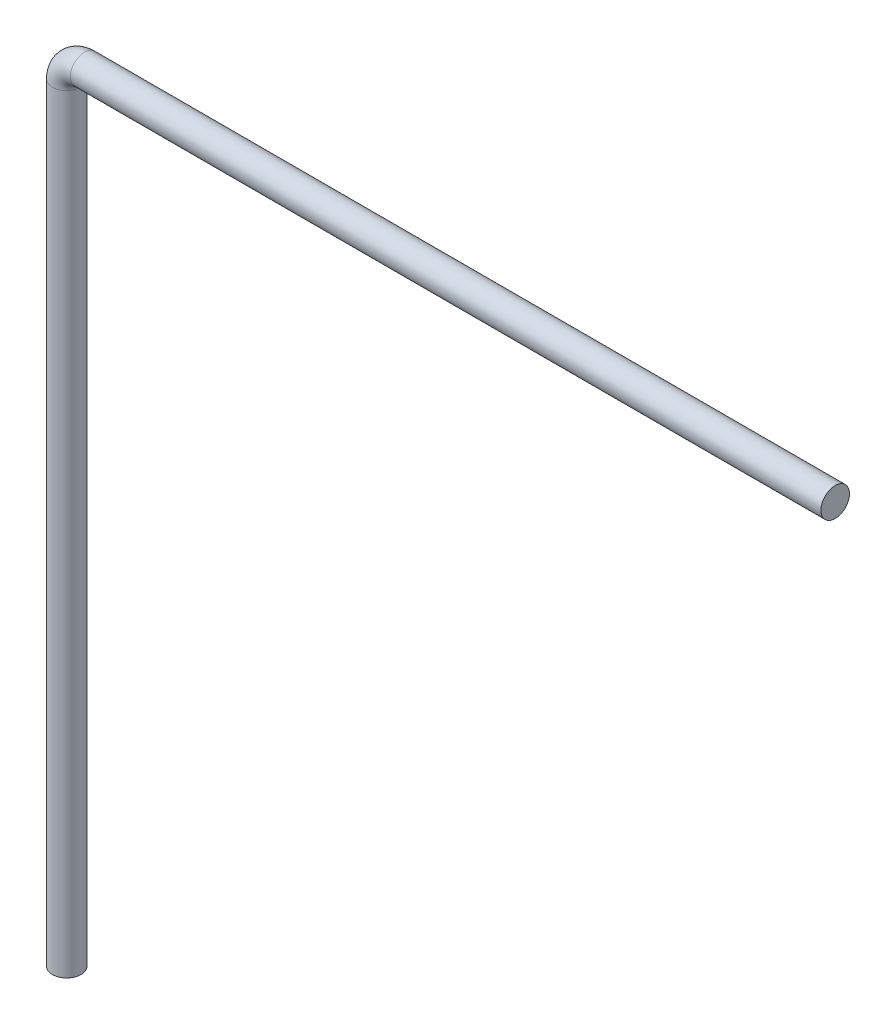
from build123d import *

# Parameters (mm, degrees)
SKETCH_2_R = 0.4


with BuildPart() as part:
    # По траектории1: sweep along a path in Эскиз1
    with BuildLine(Plane.XY) as sweep_1_path:
        Line((0, 0), (0, 21.5))
        ThreePointArc((0, 21.5), (0.146446609, 21.853553391), (0.5, 22))
        Line((0.5, 22), (21.5, 22))
    # Эскиз2 → По траектории1 (sweep)
    with BuildSketch(Plane(origin=(0, 0, 0), x_dir=(1, 0, 0), z_dir=(0, 1, 0))):
        Circle(SKETCH_2_R)
    sweep(path=sweep_1_path.line)


solid = part.part
